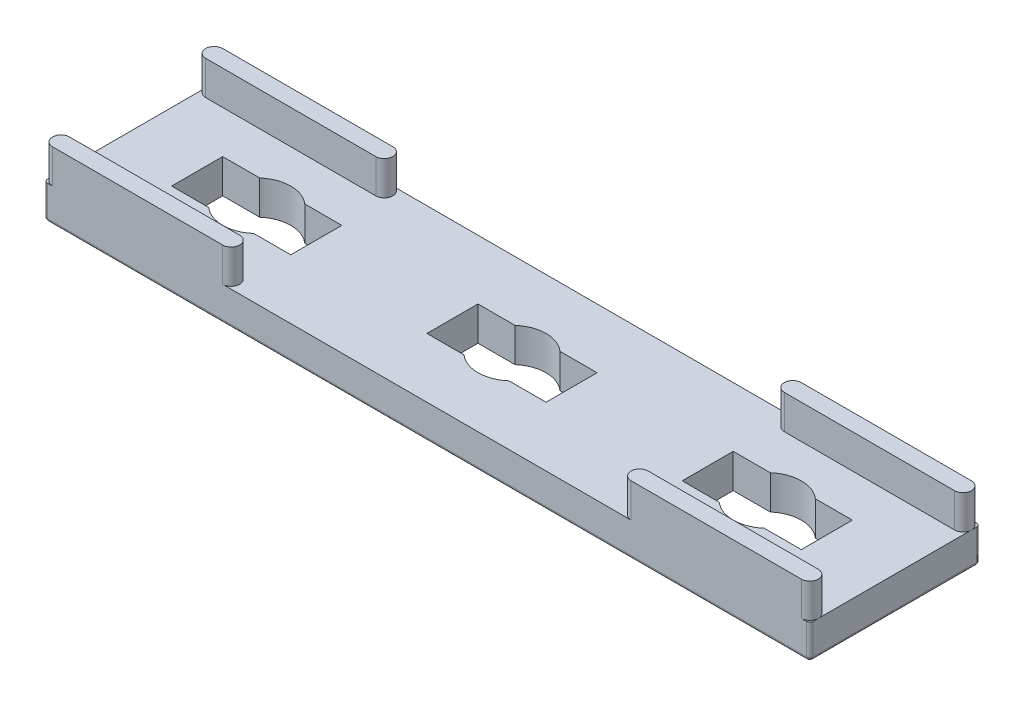
from build123d import *

# Parameters (mm, degrees)
SKETCH_1_W            = 45
SKETCH_1_H            = 10
EXTRUDE_1_DEPTH       = 2
EXTRUDE_2_DEPTH       = 2
MIRROR_2_COPY_1_DEPTH = 2
CUT_EXTRUDE_1_REACH   = 25.135
CUT_EXTRUDE_2_REACH   = 25.135
FILLET_1_R            = 0.2


with BuildPart() as part:
    # 草图1 → 凸台-拉伸1 (new body)
    with BuildSketch(Plane(origin=(0, 0, 0), x_dir=(1, 0, 0), z_dir=(0, 1, 0))):
        Rectangle(SKETCH_1_W, SKETCH_1_H)
    extrude(amount=EXTRUDE_1_DEPTH)

    # 草图2 → 凸台-拉伸2 (add)
    with BuildSketch(Plane(origin=(0, 2, 0), x_dir=(1, 0, 0), z_dir=(0, 1, 0))):
        with BuildLine():
            Line((-22, 4), (-12, 4))
            ThreePointArc((-12, 4), (-11.5, 4.5), (-12, 5))
            Line((-12, 5), (-22, 5))
            ThreePointArc((-22, 5), (-22.5, 4.5), (-22, 4))
        make_face()
    extrude_2 = extrude(amount=EXTRUDE_2_DEPTH)

    # 镜向1: 凸台-拉伸2 across plane
    add(extrude_2.mirror(Plane.XY))

    # 镜向2: 凸台-拉伸2 across plane
    add(extrude_2.mirror(Plane(origin=(0, 0, 0), x_dir=(0, 0, 1), z_dir=(1, 0, 0))))

    # 镜向2 copy 1 sketch → 镜向2 copy 1 (add)
    with BuildSketch(Plane(origin=(0, 2, 0), x_dir=(-1, 0, 0), z_dir=(0, 1, 0))):
        with BuildLine():
            Line((-22, 4), (-12, 4))
            ThreePointArc((-12, 4), (-11.5, 4.5), (-12, 5))
            Line((-12, 5), (-22, 5))
            ThreePointArc((-22, 5), (-22.5, 4.5), (-22, 4))
        make_face()
    extrude(amount=MIRROR_2_COPY_1_DEPTH)

    # 草图3 → 切除-拉伸1 (cut, up to next)
    with BuildSketch(Plane(origin=(0, 2, 0), x_dir=(1, 0, 0), z_dir=(0, 1, 0)), mode=Mode.PRIVATE) as cut_extrude_1_sk1:
        with BuildLine():
            Line((3.5, 1.5), (3.5, -1.5))
            Line((3.5, -1.5), (1.322875656, -1.5))
            ThreePointArc((1.322875656, -1.5), (0, -2), (-1.322875656, -1.5))
            Line((-1.322875656, -1.5), (-3.5, -1.5))
            Line((-3.5, -1.5), (-3.5, 1.5))
            Line((-3.5, 1.5), (-1.322875656, 1.5))
            ThreePointArc((-1.322875656, 1.5), (0, 2), (1.322875656, 1.5))
            Line((1.322875656, 1.5), (3.5, 1.5))
        make_face()
    cut_extrude_1_tool1 = extrude(cut_extrude_1_sk1.sketch, amount=-CUT_EXTRUDE_1_REACH, mode=Mode.PRIVATE) & part.part
    add(cut_extrude_1_tool1.solids().sort_by_distance((0, 2, 0))[0], mode=Mode.SUBTRACT)

    # 草图4 → 切除-拉伸2 (cut, up to next)
    with BuildSketch(Plane(origin=(0, 2, 0), x_dir=(1, 0, 0), z_dir=(0, 1, 0)), mode=Mode.PRIVATE) as cut_extrude_2_sk1:
        with BuildLine():
            Line((-11.5, 1.5), (-11.5, -1.5))
            Line((-11.5, -1.5), (-13.677124344, -1.5))
            ThreePointArc((-13.677124344, -1.5), (-15, -2), (-16.322875656, -1.5))
            Line((-16.322875656, -1.5), (-18.5, -1.5))
            Line((-18.5, -1.5), (-18.5, 1.5))
            Line((-18.5, 1.5), (-16.322875656, 1.5))
            ThreePointArc((-16.322875656, 1.5), (-15, 2), (-13.677124344, 1.5))
            Line((-13.677124344, 1.5), (-11.5, 1.5))
        make_face()
    cut_extrude_2_tool1 = extrude(cut_extrude_2_sk1.sketch, amount=-CUT_EXTRUDE_2_REACH, mode=Mode.PRIVATE) & part.part
    cut_extrude_2 = cut_extrude_2_tool1.solids().sort_by_distance((-15, 2, 0))[0]
    add(cut_extrude_2, mode=Mode.SUBTRACT)

    # 镜向3: 切除-拉伸2 across plane
    add(cut_extrude_2.mirror(Plane(origin=(0, 0, 0), x_dir=(0, 0, 1), z_dir=(1, 0, 0))), mode=Mode.SUBTRACT)

    # 圆角1
    fillet_1_edges = [part.edges().sort_by_distance(p)[0] for p in [
        (0, 0, 5),
        (-22.5, 1, 5),
        (-22.5, 0, 0),
        (-22.5, 1, -5),
        (0, 0, -5),
        (22.5, 0, 0),
        (22.5, 1, -5),
        (22.5, 1, 5),
    ]]
    fillet(fillet_1_edges, radius=FILLET_1_R)


solid = part.part
